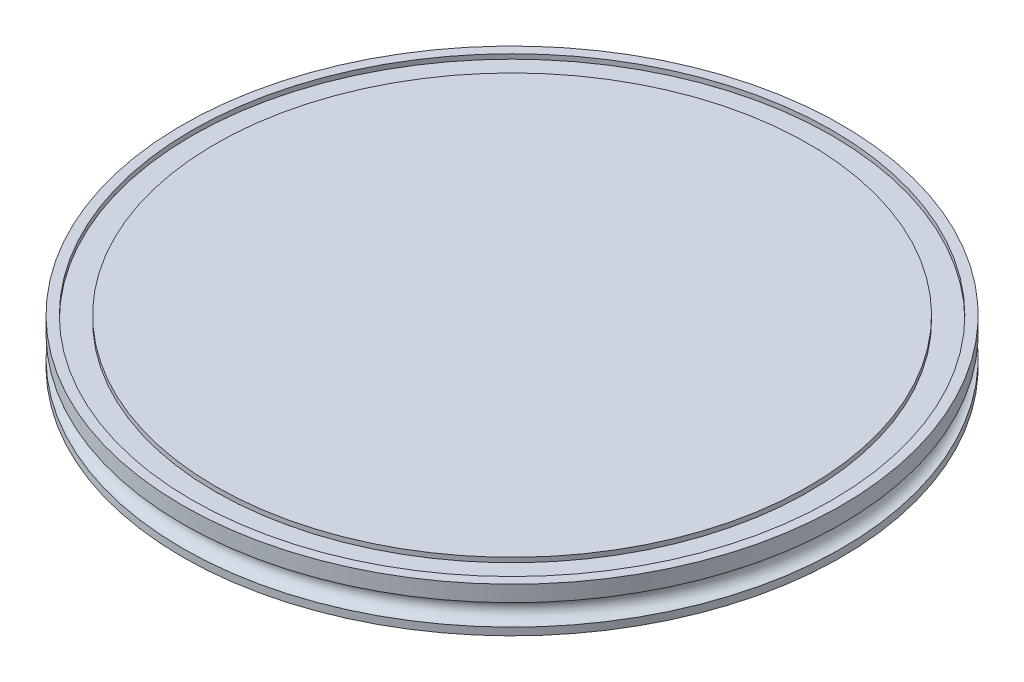
from build123d import *

# Parameters (mm, degrees)
SKETCH2_R           = 6.35
CUT_EXTRUDE1_DEPTH  = 127.301164781
SKETCH3_R           = 25.4
SKETCH3_R_2         = 12.7
CUT_EXTRUDE3_DEPTH  = 127.301164781
SKETCH4_R           = 5.715
CUT_EXTRUDE4_DEPTH  = 127.301164781
SKETCH5_R           = 6.35
SKETCH5_R_2         = 5.715
SKETCH5_R_3         = 12.7
SKETCH5_R_4         = 25.4
BOSS_EXTRUDE1_DEPTH = 12.065


with BuildPart() as part:
    # Sketch1 → Revolve2 (revolve)
    with BuildSketch(Plane.XY, mode=Mode.PRIVATE) as revolve2_sk:
        with BuildLine():
            ThreePointArc((88.9, 7.747), (86.0425, 4.8895), (88.9, 2.032))
            Line((88.9, 2.032), (88.9, 0))
            Line((88.9, 0), (76.2, 0))
            Line((76.2, 0), (76.2, 2.54))
            Line((76.2, 2.54), (69.85, 2.54))
            Line((69.85, 2.54), (69.85, 0))
            Line((69.85, 0), (0, 0))
            Line((0, 0), (0, 12.065))
            Line((0, 12.065), (80.01, 12.065))
            Line((80.01, 12.065), (80.01, 10.795))
            Line((80.01, 10.795), (86.36, 10.795))
            Line((86.36, 10.795), (86.36, 12.065))
            Line((86.36, 12.065), (88.9, 12.065))
            Line((88.9, 12.065), (88.9, 7.747))
        make_face()
    revolve(revolve2_sk.sketch.rotate(Axis((0, 28.20697446, 0), (0, -1, 0)), 90), axis=Axis((0, 28.20697446, 0), (0, -1, 0)))

    # Sketch2 → Cut-Extrude1 (cut, through all)
    with BuildSketch(Plane(origin=(0, 12.065, 0), x_dir=(1, 0, 0), z_dir=(0, 1, 0))):
        with Locations(Location((-25.4, -47.752, 0), (0, 0, 270))):
            Circle(SKETCH2_R)
        with Locations(Location((25.4, -47.752, 0), (0, 0, 270))):
            Circle(SKETCH2_R)
    extrude(amount=-CUT_EXTRUDE1_DEPTH, mode=Mode.SUBTRACT)

    # Sketch3 → Cut-Extrude3 (cut, through all)
    with BuildSketch(Plane(origin=(0, 12.065, 0), x_dir=(1, 0, 0), z_dir=(0, 1, 0))):
        with Locations(Location((0, 38.1, 0), (0, 0, 270))):
            Circle(SKETCH3_R)
        with Locations(Location((25.4, 0, 0), (0, 0, 270))):
            Circle(SKETCH3_R_2)
        with Locations(Location((-25.4, 0, 0), (0, 0, 270))):
            Circle(SKETCH3_R_2)
    extrude(amount=-CUT_EXTRUDE3_DEPTH, mode=Mode.SUBTRACT)

    # Sketch4 → Cut-Extrude4 (cut, through all)
    with BuildSketch(Plane(origin=(0, 12.065, 0), x_dir=(1, 0, 0), z_dir=(0, 1, 0))):
        with Locations(Location((50.8, -25.4, 0), (0, 0, 270))):
            Circle(SKETCH4_R)
        with Locations(Location((50.8, 25.4, 0), (0, 0, 270))):
            Circle(SKETCH4_R)
        with Locations(Location((-50.8, -25.4, 0), (0, 0, 270))):
            Circle(SKETCH4_R)
        with Locations(Location((-50.8, 25.4, 0), (0, 0, 270))):
            Circle(SKETCH4_R)
    extrude(amount=-CUT_EXTRUDE4_DEPTH, mode=Mode.SUBTRACT)

    # Sketch5 → Boss-Extrude1 (add, through all)
    with BuildSketch(Plane(origin=(0, 12.065, 0), x_dir=(1, 0, 0), z_dir=(0, 1, 0))):
        with Locations((-25.4, -47.752)):
            Circle(SKETCH5_R)
        with Locations((-50.8, -25.4)):
            Circle(SKETCH5_R_2)
        with Locations((-25.4, 0)):
            Circle(SKETCH5_R_3)
        with Locations((0, 38.1)):
            Circle(SKETCH5_R_4)
        with Locations((-50.8, 25.4)):
            Circle(SKETCH5_R_2)
        with Locations((50.8, 25.4)):
            Circle(SKETCH5_R_2)
        with Locations((25.4, 0)):
            Circle(SKETCH5_R_3)
        with Locations((25.4, -47.752)):
            Circle(SKETCH5_R)
        with Locations((50.8, -25.4)):
            Circle(SKETCH5_R_2)
    extrude(amount=-BOSS_EXTRUDE1_DEPTH)


solid = part.part
